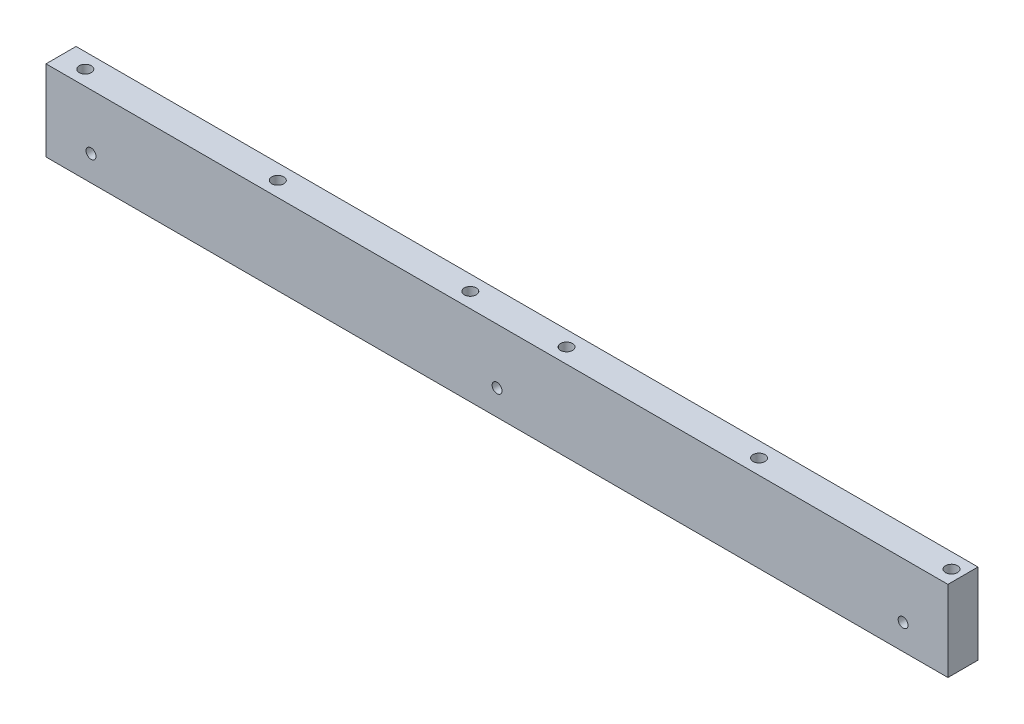
from build123d import *

# Parameters (mm, degrees)
BOSS_EXTRUDE2_DEPTH = 10
SKETCH6_R           = 1.636760028
CUT_EXTRUDE1_DEPTH  = 27
SKETCH7_R           = 1.638016743
CUT_EXTRUDE2_DEPTH  = 27
SKETCH8_R           = 1.650737017
CUT_EXTRUDE3_DEPTH  = 27
SKETCH14_R          = 2.003260407
CUT_EXTRUDE4_DEPTH  = 27


with BuildPart() as part:
    # Sketch2 → Boss-Extrude2 (new body)
    with BuildSketch(Plane.XY.offset(16)):
        Polygon((-14.961915992, 18.349138456), (-14.957534249, -8.487840275), (284.912453053, -8.438879726), (284.90807131, 18.398099005), align=None)
    extrude(amount=BOSS_EXTRUDE2_DEPTH)

    # Sketch6 → Cut-Extrude1 (cut)
    with BuildSketch(Plane(origin=(0, 0, 16), x_dir=(-1, 0, 0), z_dir=(0, 0, -1))):
        with Locations((-135.00258755, -0.00593878)):
            Circle(SKETCH6_R)
    extrude(amount=-CUT_EXTRUDE1_DEPTH, mode=Mode.SUBTRACT)

    # Sketch7 → Cut-Extrude2 (cut)
    with BuildSketch(Plane(origin=(0, 0, 16), x_dir=(-1, 0, 0), z_dir=(0, 0, -1))):
        with Locations((-269.998815676, -0.007408264)):
            Circle(SKETCH7_R)
    extrude(amount=-CUT_EXTRUDE2_DEPTH, mode=Mode.SUBTRACT)

    # Sketch8 → Cut-Extrude3 (cut)
    with BuildSketch(Plane(origin=(0, 0, 16), x_dir=(-1, 0, 0), z_dir=(0, 0, -1))):
        with Locations((-0.005146572, -0.011071128)):
            Circle(SKETCH8_R)
    extrude(amount=-CUT_EXTRUDE3_DEPTH, mode=Mode.SUBTRACT)

    # Sketch14 → Cut-Extrude4 (cut)
    with BuildSketch(Plane(origin=(-0.00299631, 18.351580838, 0), x_dir=(0.9999999866710311, 0.00016327258684284348, 0), z_dir=(-0.00016327258684284348, 0.9999999866710311, 0))):
        with Locations(Location((-6.872916807, -21.024902159, 0), (0, 0, 180))):
            Circle(SKETCH14_R)
        with Locations(Location((57.127083193, -21.024902159, 0), (0, 0, 180))):
            Circle(SKETCH14_R)
        with Locations(Location((121.127083193, -21.024902159, 0), (0, 0, 180))):
            Circle(SKETCH14_R)
        with Locations(Location((153.127083193, -21.024902159, 0), (0, 0, 180))):
            Circle(SKETCH14_R)
        with Locations(Location((217.127083193, -21.024902159, 0), (0, 0, 180))):
            Circle(SKETCH14_R)
        with Locations(Location((281.127083193, -21.024902159, 0), (0, 0, 180))):
            Circle(SKETCH14_R)
    extrude(amount=-CUT_EXTRUDE4_DEPTH, mode=Mode.SUBTRACT)


solid = part.part
